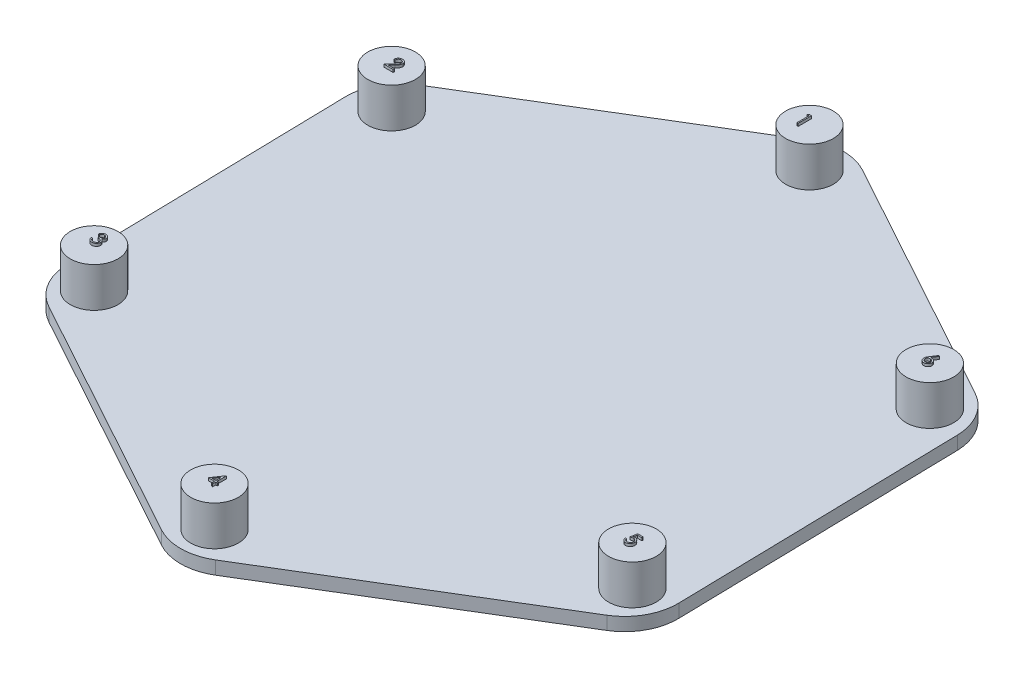
from build123d import *

# Parameters (mm, degrees)
BOSS_EXTRUDE1_DEPTH  = 25
BOSS_EXTRUDE2_DEPTH  = 10
SKETCH3_R            = 90
BOSS_EXTRUDE3_DEPTH  = 150
CIRPATTERN1_COUNT    = 6
BOSS_EXTRUDE4_DEPTH  = 10
BOSS_EXTRUDE5_DEPTH  = 10
BOSS_EXTRUDE6_DEPTH  = 10
BOSS_EXTRUDE7_DEPTH  = 10
BOSS_EXTRUDE8_DEPTH  = 10
BOSS_EXTRUDE9_DEPTH  = 10
FILLET1_R            = 200
BOSS_EXTRUDE11_DEPTH = 20
CIRPATTERN2_COUNT    = 6


with BuildPart() as part:
    # Sketch1 → Boss-Extrude1 (new, symmetric)
    with BuildSketch(Plane(origin=(0, 0, 0), x_dir=(1, 0, 0), z_dir=(0, 1, 0))):
        Polygon((-28.57133905, 1307.422876967), (-1146.547094467, 628.967933046), (-1117.975755417, -678.454943921), (28.57133905, -1307.422876967), (1146.547094467, -628.967933046), (1117.975755417, 678.454943921), align=None)
        Polygon((1068.618386374, 648.50192313), (-27.309946646, 1249.701631116), (-1095.92833302, 601.199707987), (-1068.618386374, -648.50192313), (27.309946646, -1249.701631116), (1095.92833302, -601.199707987), align=None, mode=Mode.SUBTRACT)
    extrude(amount=BOSS_EXTRUDE1_DEPTH, both=True)

    # Sketch2 → Boss-Extrude2 (add)
    with BuildSketch(Plane(origin=(0, 25, 0), x_dir=(1, 0, 0), z_dir=(0, 1, 0))):
        Polygon((1117.975755417, 678.454943921), (-28.57133905, 1307.422876967), (-1146.547094467, 628.967933046), (-1117.975755417, -678.454943921), (28.57133905, -1307.422876967), (1146.547094467, -628.967933046), align=None)
    extrude(amount=-BOSS_EXTRUDE2_DEPTH)

    # Sketch3 → Boss-Extrude3 (add)
    with BuildSketch(Plane(origin=(0, 25, 0), x_dir=(1, 0, 0), z_dir=(0, 1, 0))):
        with Locations(Location((-1008.254066379, 553.103731348, 0), (0, 0, 270))):
            Circle(SKETCH3_R)
    boss_extrude3 = extrude(amount=BOSS_EXTRUDE3_DEPTH)

    # CirPattern1: Boss-Extrude3 ×6 about axis
    cirpattern1_axis = Axis((0, 0, 0), (0, 1, 0))
    for i in range(1, CIRPATTERN1_COUNT):
        add(boss_extrude3.rotate(cirpattern1_axis, i * 360 / CIRPATTERN1_COUNT))

    # Sketch5 → Boss-Extrude4 (add)
    with BuildSketch(Plane(origin=(0, 175, 0), x_dir=(1, 0, 0), z_dir=(0, 1, 0))):
        Polygon((-50.30953318, 1173.045761191), (-41.064741514, 1173.045761191), (-41.064741514, 1123.045761191), (-45.551921001, 1123.045761191), (-45.551921001, 1167.917556063), (-53.244228693, 1167.917556063), align=None)
    extrude(amount=BOSS_EXTRUDE4_DEPTH)

    # Sketch6 → Boss-Extrude5 (add)
    with BuildSketch(Plane(origin=(0, 175, 0), x_dir=(1, 0, 0), z_dir=(0, 1, 0))):
        with BuildLine():
            Line((-1010.68012499, 568.449882479), (-1015.167304477, 568.449882479))
            add(Edge.make_bspline(
                [(-1015.167304477, 568.449882479), (-1015.138059434, 569.045180876), (-1015.080622948, 570.214331084), (-1014.811647387, 571.918958318), (-1014.426777713, 573.548312586), (-1013.882614084, 575.089311357), (-1013.206810116, 576.555580032), (-1012.396381153, 577.941294542), (-1011.436469003, 579.241168666), (-1010.347801374, 580.443152142), (-1009.165392244, 581.545831725), (-1007.889593109, 582.498049479), (-1006.548949862, 583.302587641), (-1005.147529877, 583.97517681), (-1003.669521826, 584.480031752), (-1002.128338143, 584.854626603), (-1000.517207623, 585.080002971), (-999.419493022, 585.104228479), (-998.861214733, 585.116549146)],
                knots=[0, 0, 0, 0, 1.10065271, 2.161652631, 3.183658789, 4.190468796, 5.17591951, 6.163126047, 7.15150782, 8.156236427, 9.156009102, 10.134482811, 11.092018607, 12.041330605, 13.001268258, 13.972401359, 14.968799086, 16, 16, 16, 16], degree=3))
            add(Edge.make_bspline(
                [(-998.861214733, 585.116549146), (-998.312956532, 585.103714054), (-997.235648751, 585.078493556), (-995.663334259, 584.861907424), (-994.166515767, 584.522684686), (-992.748119102, 584.046750168), (-991.419461037, 583.406972633), (-990.1705604, 582.638436367), (-988.986548818, 581.749581633), (-987.920737623, 580.703098584), (-986.942050777, 579.585921663), (-986.097732846, 578.393237325), (-985.374687654, 577.161390387), (-984.772006513, 575.880987507), (-984.328347385, 574.539972815), (-983.991515842, 573.157869918), (-983.801124218, 571.720372618), (-983.771903882, 570.747421823), (-983.757048067, 570.252767095)],
                knots=[0, 0, 0, 0, 1.111607364, 2.184268762, 3.212621178, 4.221274766, 5.211760367, 6.196651075, 7.1921475, 8.207485113, 9.220403448, 10.201281604, 11.166441695, 12.114753415, 13.065576456, 14.026450734, 14.996634279, 16, 16, 16, 16], degree=3))
            add(Edge.make_bspline(
                [(-983.757048067, 570.252767095), (-983.781237536, 569.556369458), (-983.829191984, 568.175794977), (-984.239397363, 566.147011223), (-984.880061808, 564.181390951), (-985.65145262, 562.599429492), (-986.429630392, 561.324665296), (-987.130880501, 560.275112368), (-987.951806372, 559.145034248), (-988.904356343, 557.938215143), (-989.968825945, 556.645202213), (-991.15485685, 555.266776565), (-992.470906594, 553.817179853), (-993.394599462, 552.827099833), (-993.873233964, 552.314065172)],
                knots=[0, 0, 0, 0, 1.184426356, 2.348067706, 3.509069118, 4.696110526, 5.333549288, 6.050745305, 6.844228056, 7.710549037, 8.667450064, 9.695053472, 10.805634456, 12, 12, 12, 12], degree=3))
            Line((-993.873233964, 552.314065172), (-1006.38324999, 538.962702992))
            Line((-1006.38324999, 538.962702992), (-983.116022426, 538.962702992))
            Line((-983.116022426, 538.962702992), (-983.116022426, 533.834497864))
            Line((-983.116022426, 533.834497864), (-1017.0903814, 533.834497864))
            Line((-1017.0903814, 533.834497864), (-997.699355759, 554.527606838))
            add(Edge.make_bspline(
                [(-997.699355759, 554.527606838), (-997.22724309, 555.020439789), (-996.320411274, 555.967071026), (-995.037803034, 557.349113314), (-993.885817487, 558.63124961), (-992.85699759, 559.811057445), (-991.973661799, 560.905794128), (-991.189772771, 561.880004179), (-990.5616929, 562.776496326), (-989.88004439, 563.815647954), (-989.219844656, 565.084395342), (-988.652525284, 566.634876617), (-988.306598878, 568.230980227), (-988.265101228, 569.309580756), (-988.244227554, 569.852126069)],
                knots=[0, 0, 0, 0, 1.329631726, 2.553950428, 3.673215718, 4.687767853, 5.603093632, 6.413772471, 7.123043292, 7.734684054, 8.834405432, 9.900288307, 10.943827018, 12, 12, 12, 12], degree=3))
            add(Edge.make_bspline(
                [(-988.244227554, 569.852126069), (-988.253309587, 570.193288903), (-988.27120853, 570.865655337), (-988.429175637, 571.851451895), (-988.667897152, 572.802377806), (-989.009972267, 573.721358079), (-989.461497126, 574.599153109), (-990.011116839, 575.436831398), (-990.645260602, 576.246673758), (-991.378850164, 577.006006587), (-992.184729018, 577.70145238), (-993.036075441, 578.317510743), (-993.936791216, 578.832355183), (-994.883078675, 579.254405142), (-995.872299667, 579.585482017), (-996.906367454, 579.814890294), (-997.98242483, 579.958925779), (-998.717189054, 579.978413949), (-999.091583323, 579.988344018)],
                knots=[0, 0, 0, 0, 0.991446411, 1.95395049, 2.89581595, 3.838931463, 4.798493298, 5.75982156, 6.748411868, 7.785213223, 8.824556874, 9.840280684, 10.836137867, 11.835679398, 12.848801643, 13.863922112, 14.911575587, 16, 16, 16, 16], degree=3))
            add(Edge.make_bspline(
                [(-999.091583323, 579.988344018), (-999.48259522, 579.978129271), (-1000.250478023, 579.958069195), (-1001.377892779, 579.817745424), (-1002.453403887, 579.57566199), (-1003.479716786, 579.244566641), (-1004.458568012, 578.82373023), (-1005.385197212, 578.299562449), (-1006.257524202, 577.674083975), (-1007.077188821, 576.96493317), (-1007.832388522, 576.17539601), (-1008.49591532, 575.295253681), (-1009.075686951, 574.340576318), (-1009.581533143, 573.313939881), (-1009.992328716, 572.206028739), (-1010.306230865, 571.020775812), (-1010.554614389, 569.763327506), (-1010.637593255, 568.894969151), (-1010.68012499, 568.449882479)],
                knots=[0, 0, 0, 0, 1.031018746, 2.02475058, 2.990194455, 3.934040569, 4.864654155, 5.795059489, 6.735614925, 7.690564532, 8.649604399, 9.611025574, 10.590972636, 11.591080095, 12.624614302, 13.701020113, 14.821632451, 16, 16, 16, 16], degree=3))
        make_face()
    extrude(amount=BOSS_EXTRUDE5_DEPTH)

    # Sketch7 → Boss-Extrude6 (add)
    with BuildSketch(Plane(origin=(0, 175, 0), x_dir=(1, 0, 0), z_dir=(0, 1, 0))):
        with BuildLine():
            Line((-997.390351393, -561.773098716), (-1001.87753088, -561.773098716))
            add(Edge.make_bspline(
                [(-1001.87753088, -561.773098716), (-1001.75596587, -561.269777516), (-1001.518316219, -560.285825739), (-1001.022636598, -558.880007727), (-1000.482647238, -557.549671707), (-999.834231459, -556.319727797), (-999.126963541, -555.165457758), (-998.316638948, -554.113041694), (-997.440642911, -553.135713616), (-996.471715064, -552.268381651), (-995.455591326, -551.48298552), (-994.377953901, -550.813341843), (-993.260483992, -550.237282517), (-992.095439235, -549.762707776), (-990.879351068, -549.405200295), (-989.623213592, -549.145817358), (-988.323735019, -548.977372869), (-987.441626582, -548.960933396), (-986.993716777, -548.952585895)],
                knots=[0, 0, 0, 0, 1.162005537, 2.271625781, 3.343758855, 4.383309926, 5.390229558, 6.379919256, 7.361854164, 8.333198761, 9.295911338, 10.242430842, 11.177959212, 12.116337295, 13.062827104, 14.020064771, 14.994644689, 16, 16, 16, 16], degree=3))
            add(Edge.make_bspline(
                [(-986.993716777, -548.952585895), (-986.341106176, -548.972289184), (-985.050120306, -549.011265977), (-983.153505349, -549.367186498), (-981.324550791, -549.930402675), (-979.583275822, -550.708598777), (-977.965869642, -551.668417536), (-976.52678126, -552.81077092), (-975.28551682, -554.113618084), (-974.244168567, -555.552654717), (-973.428811438, -557.090590566), (-972.827577531, -558.673449954), (-972.461553517, -560.297478116), (-972.414116991, -561.394010676), (-972.390351393, -561.943371152)],
                knots=[0, 0, 0, 0, 1.083050992, 2.142477498, 3.193116406, 4.255571735, 5.30263384, 6.308962982, 7.297363603, 8.282367274, 9.249857812, 10.179914175, 11.08814088, 12, 12, 12, 12], degree=3))
            add(Edge.make_bspline(
                [(-972.390351393, -561.943371152), (-972.406974122, -562.472039647), (-972.439502224, -563.506561854), (-972.715698017, -565.016868956), (-973.180501773, -566.440320389), (-973.824355524, -567.782908419), (-974.657806241, -569.036120416), (-975.667416197, -570.202776), (-976.860311365, -571.288049688), (-977.764296194, -571.909756445), (-978.229694341, -572.229829485)],
                knots=[0, 0, 0, 0, 1.024540389, 2.004866551, 2.965041327, 3.920577974, 4.882998113, 5.874504559, 6.905732034, 8, 8, 8, 8], degree=3))
            add(Edge.make_bspline(
                [(-978.229694341, -572.229829485), (-977.697812133, -572.486660507), (-976.643999644, -572.995517044), (-975.207563507, -573.993456437), (-973.90359386, -575.145689971), (-973.176397874, -576.044870727), (-972.81102447, -576.496656408)],
                knots=[0, 0, 0, 0, 1.015518401, 2.012035669, 3.001164323, 4, 4, 4, 4], degree=3))
            add(Edge.make_bspline(
                [(-972.81102447, -576.496656408), (-972.570433865, -576.82605286), (-972.093192492, -577.479451668), (-971.504113439, -578.529972038), (-970.96969752, -579.59213617), (-970.553265815, -580.694413399), (-970.230782003, -581.824027881), (-970.000267257, -582.982919253), (-969.857065244, -584.172033859), (-969.836557359, -584.976497862), (-969.826248829, -585.380871152)],
                knots=[0, 0, 0, 0, 1.025084078, 2.033381695, 3.024893161, 4.013698104, 4.991890475, 5.976764909, 6.982997093, 8, 8, 8, 8], degree=3))
            add(Edge.make_bspline(
                [(-969.826248829, -585.380871152), (-969.851884736, -586.081010026), (-969.903035908, -587.477992909), (-970.360236969, -589.541917504), (-971.068997551, -591.559424679), (-972.075525207, -593.48906524), (-973.302203905, -595.294499254), (-974.76159425, -596.909875098), (-976.43711437, -598.298426588), (-978.305766497, -599.458572703), (-980.330296904, -600.385971592), (-982.495662504, -601.029649347), (-984.770663275, -601.448877913), (-986.330767525, -601.493833183), (-987.123925111, -601.516688459)],
                knots=[0, 0, 0, 0, 0.955779014, 1.907060117, 2.875433937, 3.871313158, 4.872415639, 5.851225146, 6.836215519, 7.83643374, 8.849228613, 9.86973379, 10.916971861, 12, 12, 12, 12], degree=3))
            add(Edge.make_bspline(
                [(-987.123925111, -601.516688459), (-987.658486543, -601.504285413), (-988.710325187, -601.479880353), (-990.256660878, -601.313043193), (-991.732685155, -601.008328833), (-993.140393696, -600.598281613), (-994.481037073, -600.078399583), (-995.75052429, -599.430989612), (-996.956665626, -598.669396725), (-998.088079213, -597.784631185), (-999.144630181, -596.79489776), (-1000.098240527, -595.682626189), (-1000.964808997, -594.468377562), (-1001.721132408, -593.138048187), (-1002.401660302, -591.708830226), (-1002.961388254, -590.162423107), (-1003.454039235, -588.512651364), (-1003.683088724, -587.362969361), (-1003.800607803, -586.773098716)],
                knots=[0, 0, 0, 0, 1.048658725, 2.063410685, 3.046034179, 4.001477787, 4.936774919, 5.862367409, 6.792675028, 7.730719943, 8.675894397, 9.627829632, 10.600096036, 11.597688215, 12.626045268, 13.701542398, 14.82072376, 16, 16, 16, 16], degree=3))
            Line((-1003.800607803, -586.773098716), (-999.313428316, -586.773098716))
            add(Edge.make_bspline(
                [(-999.313428316, -586.773098716), (-999.196524152, -587.15808462), (-998.9691354, -587.906915643), (-998.582074, -588.984634295), (-998.141098684, -589.972606484), (-997.668033561, -590.878079655), (-997.171198618, -591.709971119), (-996.615271116, -592.446283534), (-996.041426185, -593.119357851), (-995.608863994, -593.498566593), (-995.39716229, -593.684156408)],
                knots=[0, 0, 0, 0, 1.198163088, 2.33053128, 3.407730985, 4.417276592, 5.372219308, 6.28897303, 7.162600585, 8, 8, 8, 8], degree=3))
            add(Edge.make_bspline(
                [(-995.39716229, -593.684156408), (-995.117211197, -593.899989749), (-994.558173156, -594.330990203), (-993.647198426, -594.881013468), (-992.689128625, -595.357599544), (-991.663204707, -595.72165234), (-990.591565129, -596.029904637), (-989.456888483, -596.231626339), (-988.269185381, -596.370028787), (-987.458217332, -596.382242094), (-987.043796905, -596.388483331)],
                knots=[0, 0, 0, 0, 0.946170439, 1.889420265, 2.845303464, 3.807233317, 4.801018734, 5.828864929, 6.890507805, 8, 8, 8, 8], degree=3))
            add(Edge.make_bspline(
                [(-987.043796905, -596.388483331), (-986.575889725, -596.379684685), (-985.660937626, -596.362479691), (-984.325868207, -596.204255308), (-983.055761813, -595.97382083), (-981.864720016, -595.617921075), (-980.73714134, -595.178194626), (-979.68883206, -594.626074548), (-978.706030543, -593.978292811), (-977.801324751, -593.242019116), (-976.987817501, -592.435997758), (-976.27153874, -591.592953885), (-975.662615005, -590.716442034), (-975.171421031, -589.801611736), (-974.783556026, -588.852251323), (-974.519510304, -587.865696618), (-974.335917231, -586.850021387), (-974.320965628, -586.159607544), (-974.313428316, -585.811560254)],
                knots=[0, 0, 0, 0, 1.217147791, 2.380027433, 3.494444702, 4.572153297, 5.609568379, 6.639424714, 7.649109417, 8.668170816, 9.669597737, 10.625200337, 11.543417969, 12.441394052, 13.322311151, 14.205496177, 15.095365482, 16, 16, 16, 16], degree=3))
            add(Edge.make_bspline(
                [(-974.313428316, -585.811560254), (-974.335289766, -585.345683985), (-974.378903887, -584.416249581), (-974.711883594, -583.048855663), (-975.259581654, -581.731378342), (-976.026331815, -580.486295627), (-976.959699367, -579.332354177), (-978.050626608, -578.30276157), (-979.308172728, -577.45318884), (-980.465599428, -576.866208035), (-981.49081595, -576.465678389), (-982.368178585, -576.198893183), (-983.350415776, -575.972983816), (-984.425649331, -575.762808508), (-985.601980995, -575.583932106), (-986.878130109, -575.43476331), (-988.254355274, -575.315405582), (-989.207086215, -575.262104221), (-989.6980437, -575.234637177)],
                knots=[0, 0, 0, 0, 1.07054697, 2.135767047, 3.216561865, 4.33974944, 5.486079747, 6.621378074, 7.775625952, 8.963672916, 9.598146892, 10.304877434, 11.070270905, 11.915000392, 12.823868403, 13.805723172, 14.86925407, 16, 16, 16, 16], degree=3))
            Line((-989.6980437, -575.234637177), (-989.6980437, -570.106432049))
            add(Edge.make_bspline(
                [(-989.6980437, -570.106432049), (-989.079455619, -570.095934853), (-987.867793525, -570.075373425), (-986.097874886, -569.826687562), (-984.405398998, -569.48267859), (-982.827874112, -568.955747272), (-981.39003535, -568.343743031), (-980.142612463, -567.631568609), (-979.103081788, -566.839929334), (-978.276495052, -565.956606344), (-977.654648929, -565.009248522), (-977.199980394, -564.021867698), (-976.931404305, -562.985809685), (-976.89555192, -562.278743), (-976.87753088, -561.9233391)],
                knots=[0, 0, 0, 0, 1.321986639, 2.589447074, 3.816329219, 5.01088745, 6.139805852, 7.153945165, 8.075214402, 8.924034688, 9.728124013, 10.488707548, 11.240355623, 12, 12, 12, 12], degree=3))
            add(Edge.make_bspline(
                [(-976.87753088, -561.9233391), (-976.883451036, -561.662228456), (-976.895228907, -561.142761211), (-977.043761447, -560.383831659), (-977.266962032, -559.64810386), (-977.573815308, -558.93870657), (-977.984532433, -558.2605598), (-978.476046526, -557.607881958), (-979.061305101, -556.984399401), (-979.731954344, -556.403251979), (-980.452122987, -555.849405734), (-981.241405487, -555.37921092), (-982.076003698, -554.977138604), (-982.956841624, -554.645574289), (-983.886777771, -554.396155885), (-984.861442881, -554.217072437), (-985.882695502, -554.105105941), (-986.579434531, -554.088985713), (-986.933620623, -554.080791023)],
                knots=[0, 0, 0, 0, 0.884392785, 1.759457502, 2.611959086, 3.489218968, 4.37281399, 5.2945488, 6.255912374, 7.266815255, 8.301784654, 9.332968512, 10.37626691, 11.440494194, 12.520033166, 13.637162961, 14.798855837, 16, 16, 16, 16], degree=3))
            add(Edge.make_bspline(
                [(-986.933620623, -554.080791023), (-987.502930166, -554.100667624), (-988.614924115, -554.139491246), (-990.217994356, -554.479534296), (-991.708270556, -555.022078346), (-992.847394365, -555.669692909), (-993.688573995, -556.308984821), (-994.289673113, -556.867304626), (-994.879966118, -557.487773536), (-995.420618645, -558.208607468), (-995.96738974, -558.980990185), (-996.465169191, -559.844185636), (-996.94887908, -560.775676983), (-997.240344075, -561.434186048), (-997.390351393, -561.773098716)],
                knots=[0, 0, 0, 0, 1.472543308, 2.876219568, 4.221790263, 5.565193594, 6.249813518, 6.953379497, 7.687249741, 8.463570142, 9.283606569, 10.136032583, 11.040678096, 12, 12, 12, 12], degree=3))
        make_face()
    extrude(amount=BOSS_EXTRUDE6_DEPTH)

    # Sketch8 → Boss-Extrude7 (add)
    with BuildSketch(Plane(origin=(0, 175, 0), x_dir=(1, 0, 0), z_dir=(0, 1, 0))):
        Polygon((31.342849512, -1112.370816369), (32.254307845, -1112.370816369), (32.254307845, -1146.986200984), (38.023538614, -1146.986200984), (38.023538614, -1152.114406112), (32.254307845, -1152.114406112), (32.254307845, -1163.652867651), (27.767128358, -1163.652867651), (27.767128358, -1152.114406112), (4.04917964, -1152.114406112), align=None)
        Polygon((27.767128358, -1146.986200984), (27.767128358, -1125.271457394), (12.863282204, -1146.986200984), align=None, mode=Mode.SUBTRACT)
    extrude(amount=BOSS_EXTRUDE7_DEPTH)

    # Sketch9 → Boss-Extrude8 (add)
    with BuildSketch(Plane(origin=(0, 175, 0), x_dir=(1, 0, 0), z_dir=(0, 1, 0))):
        with BuildLine():
            Line((1020.200037828, -524.076463643), (1020.200037828, -529.204668771))
            Line((1020.200037828, -529.204668771), (1003.19282629, -529.204668771))
            Line((1003.19282629, -529.204668771), (1000.498515393, -542.355710437))
            add(Edge.make_bspline(
                [(1000.498515393, -542.355710437), (1001.027885026, -542.209563697), (1002.053454967, -541.926427503), (1003.567167266, -541.612059354), (1005.004198745, -541.42255301), (1005.936704036, -541.396677146), (1006.387938469, -541.38415595)],
                knots=[0, 0, 0, 0, 1.100273476, 2.13160584, 3.095893838, 4, 4, 4, 4], degree=3))
            add(Edge.make_bspline(
                [(1006.387938469, -541.38415595), (1006.946277608, -541.396240746), (1008.044111856, -541.420002473), (1009.650382527, -541.648171751), (1011.183709573, -542.007313389), (1012.64088629, -542.509035128), (1014.024608442, -543.150602745), (1015.322145034, -543.952030464), (1016.552972363, -544.888220909), (1017.695009419, -545.964578223), (1018.731070964, -547.149172748), (1019.642013674, -548.42285662), (1020.415764964, -549.773251794), (1021.038061462, -551.21326049), (1021.534980523, -552.726962681), (1021.865723307, -554.330285289), (1022.085962006, -556.008115575), (1022.110567525, -557.155323719), (1022.123114752, -557.740325822)],
                knots=[0, 0, 0, 0, 1.052922333, 2.070308379, 3.05430497, 4.020497103, 4.973039431, 5.925935799, 6.892292201, 7.88610001, 8.88166317, 9.857072816, 10.836096531, 11.812156883, 12.81219415, 13.836441305, 14.89672472, 16, 16, 16, 16], degree=3))
            add(Edge.make_bspline(
                [(1022.123114752, -557.740325822), (1022.113613676, -558.147786113), (1022.094739924, -558.957200221), (1021.998760101, -560.159260231), (1021.813964157, -561.335872132), (1021.565853813, -562.487192015), (1021.24381927, -563.611040189), (1020.853975643, -564.710633445), (1020.376889536, -565.779127828), (1019.853584175, -566.826633471), (1019.264348775, -567.829469288), (1018.610370098, -568.767311953), (1017.919434509, -569.65423026), (1017.175986146, -570.48071216), (1016.373114787, -571.241326701), (1015.520543832, -571.940587865), (1014.625076417, -572.590321155), (1013.67285867, -573.164152515), (1012.685108913, -573.692194746), (1011.647562954, -574.125388136), (1010.583838662, -574.512681395), (1009.478626153, -574.821388932), (1008.33442883, -575.063282568), (1007.149360609, -575.227576862), (1005.929636751, -575.347240255), (1005.102850857, -575.354731068), (1004.685214111, -575.358514925)],
                knots=[0, 0, 0, 0, 1.056347294, 2.098418968, 3.122841568, 4.141288669, 5.149314143, 6.15115421, 7.162517403, 8.180376062, 9.185164535, 10.17417709, 11.141909838, 12.097768115, 13.052685741, 14.0056014, 14.954263652, 15.917497458, 16.885230207, 17.854509472, 18.828990115, 19.81800267, 20.826176721, 21.857883937, 22.917946725, 24, 24, 24, 24], degree=3))
            add(Edge.make_bspline(
                [(1004.685214111, -575.358514925), (1004.187011529, -575.348645811), (1003.206856805, -575.329229495), (1001.770848704, -575.126108277), (1000.389211479, -574.835195185), (999.073067177, -574.397534187), (997.810620553, -573.849144263), (996.618867442, -573.156056099), (995.467356355, -572.370640331), (994.402898687, -571.443778146), (993.414954209, -570.430696974), (992.530575511, -569.3313021), (991.742952986, -568.163738642), (991.064699458, -566.922336441), (990.486156296, -565.610357428), (990.031656464, -564.222885986), (989.664822822, -562.767171644), (989.509631101, -561.764978638), (989.430807059, -561.255950822)],
                knots=[0, 0, 0, 0, 1.0467383, 2.05933395, 3.04377827, 4.011590433, 4.970194871, 5.932262533, 6.905835911, 7.896367577, 8.894135286, 9.877477877, 10.858688626, 11.851381753, 12.8477658, 13.868841284, 14.917554742, 16, 16, 16, 16], degree=3))
            Line((989.430807059, -561.255950822), (993.917986546, -561.255950822))
            add(Edge.make_bspline(
                [(993.917986546, -561.255950822), (994.028394509, -561.732757286), (994.240604744, -562.649205784), (994.706401155, -563.936796374), (995.275913661, -565.084213855), (995.953118639, -566.106636474), (996.760976217, -566.998193577), (997.682825202, -567.792723034), (998.716364105, -568.509510595), (999.864838812, -569.106978698), (1001.076454231, -569.616532318), (1002.344557231, -569.955842246), (1003.634619324, -570.19442643), (1004.507167469, -570.218308727), (1004.945630777, -570.230309796)],
                knots=[0, 0, 0, 0, 1.136247022, 2.183929868, 3.172523383, 4.106158343, 5.02341133, 5.958108904, 6.928429099, 7.938127109, 8.96079061, 9.975095812, 10.982467395, 12, 12, 12, 12], degree=3))
            add(Edge.make_bspline(
                [(1004.945630777, -570.230309796), (1005.373608555, -570.218584398), (1006.2163003, -570.195496992), (1007.456462967, -570.017796819), (1008.653789741, -569.744117229), (1009.796466267, -569.334547872), (1010.904488261, -568.83676618), (1011.949827838, -568.197979383), (1012.962726083, -567.462836262), (1013.911699419, -566.62059869), (1014.780834409, -565.692460196), (1015.548778996, -564.699926004), (1016.188449188, -563.64111391), (1016.727507886, -562.534354584), (1017.136840726, -561.367518053), (1017.428854744, -560.146072693), (1017.600327013, -558.867001548), (1017.623915298, -557.994582836), (1017.635935264, -557.550021335)],
                knots=[0, 0, 0, 0, 1.027316725, 2.022795036, 3.002884548, 3.971462791, 4.93288096, 5.914575861, 6.907176829, 7.935150275, 8.956128384, 9.956726525, 10.942570165, 11.921478529, 12.907843606, 13.90538589, 14.932640048, 16, 16, 16, 16], degree=3))
            add(Edge.make_bspline(
                [(1017.635935264, -557.550021335), (1017.626528415, -557.148939169), (1017.608115846, -556.363877897), (1017.457679127, -555.215317805), (1017.196008093, -554.128560057), (1016.832809808, -553.098356715), (1016.371673984, -552.12373611), (1015.808155236, -551.203692393), (1015.131678123, -550.350351918), (1014.358936857, -549.563315438), (1013.512393415, -548.836960083), (1012.577482807, -548.217758848), (1011.573769567, -547.696845738), (1010.513346717, -547.247302905), (1009.370991023, -546.924435114), (1008.169324846, -546.68203675), (1006.895371875, -546.541817283), (1006.024362045, -546.522361735), (1005.576640393, -546.512361078)],
                knots=[0, 0, 0, 0, 1.045622112, 2.046656509, 3.013763289, 3.955457236, 4.890082067, 5.820317437, 6.762574623, 7.722996705, 8.69280354, 9.665887285, 10.63943826, 11.638615906, 12.663482002, 13.728887084, 14.832589034, 16, 16, 16, 16], degree=3))
            add(Edge.make_bspline(
                [(1005.576640393, -546.512361078), (1005.189084267, -546.520655238), (1004.388879191, -546.537780573), (1003.161410237, -546.663873385), (1001.871528481, -546.867291876), (1000.524178544, -547.147095412), (999.115314143, -547.513253651), (997.647908418, -547.952032231), (996.118876038, -548.476632213), (995.088622832, -548.872806695), (994.559012187, -549.076463643)],
                knots=[0, 0, 0, 0, 0.817624296, 1.688186739, 2.600797293, 3.572016777, 4.590301741, 5.671205678, 6.80286297, 8, 8, 8, 8], degree=3))
            Line((994.559012187, -549.076463643), (999.687217316, -524.076463643))
            Line((999.687217316, -524.076463643), (1020.200037828, -524.076463643))
        make_face()
    extrude(amount=BOSS_EXTRUDE8_DEPTH)

    # Sketch10 → Boss-Extrude9 (add)
    with BuildSketch(Plane(origin=(0, 175, 0), x_dir=(1, 0, 0), z_dir=(0, 1, 0))):
        with BuildLine():
            Line((985.196446995, 629.38361374), (988.651975841, 626.669270791))
            Line((988.651975841, 626.669270791), (975.44083802, 606.466947073))
            add(Edge.make_bspline(
                [(975.44083802, 606.466947073), (976.320413406, 606.607145082), (978.036124645, 606.880617151), (979.772780339, 606.925730658), (980.619123277, 606.947716304)],
                knots=[0, 0, 0, 0, 1.025318673, 2, 2, 2, 2], degree=3))
            add(Edge.make_bspline(
                [(980.619123277, 606.947716304), (981.127301796, 606.934057565), (982.127636088, 606.907170745), (983.59630469, 606.700258592), (985.007575204, 606.374185565), (986.355598237, 605.898867623), (987.645212263, 605.291691132), (988.883817922, 604.563992985), (990.048132352, 603.678197551), (991.153149198, 602.688698183), (992.156393446, 601.592741261), (993.044622811, 600.429865023), (993.790719836, 599.201281008), (994.396061574, 597.907611495), (994.866131268, 596.550850644), (995.208811911, 595.132734366), (995.411377523, 593.652284774), (995.438884533, 592.645453698), (995.452857251, 592.134014381)],
                knots=[0, 0, 0, 0, 1.04369286, 2.054478336, 3.041073146, 4.015093852, 4.984733326, 5.965804835, 6.960378782, 7.985147595, 9.009457201, 10.008161701, 10.986880575, 11.956520048, 12.937015923, 13.931873656, 14.949455224, 16, 16, 16, 16], degree=3))
            add(Edge.make_bspline(
                [(995.452857251, 592.134014381), (995.432527181, 591.434304324), (995.392522415, 590.057440525), (994.993896758, 588.052059005), (994.374473261, 586.141594497), (993.489079998, 584.356549192), (992.38933167, 582.699369627), (991.048223203, 581.231005835), (989.513316227, 579.921433873), (987.777790539, 578.826339313), (985.910033909, 577.932010013), (983.947862517, 577.289649412), (981.910331855, 576.894171277), (980.527408883, 576.844591239), (979.827857251, 576.819511175)],
                knots=[0, 0, 0, 0, 1.031375318, 2.029502543, 3.004789286, 3.987476834, 4.960371455, 5.9300674, 6.912260825, 7.929083631, 8.949397511, 9.960523116, 10.96833055, 12, 12, 12, 12], degree=3))
            add(Edge.make_bspline(
                [(979.827857251, 576.819511175), (979.155047242, 576.841342686), (977.822328413, 576.884587086), (975.861859924, 577.26981477), (973.978102533, 577.894201953), (972.184254235, 578.754405932), (970.522531193, 579.840947117), (969.035879244, 581.148979676), (967.731711036, 582.650543463), (966.646359308, 584.345405566), (965.78552028, 586.166690674), (965.139949922, 588.065792908), (964.762860733, 590.035792647), (964.710167063, 591.371237492), (964.683626482, 592.04387015)],
                knots=[0, 0, 0, 0, 1.012016664, 2.004627821, 2.994792927, 3.992885782, 4.990978636, 5.973936114, 6.964471063, 7.975201453, 8.993600317, 9.990122807, 10.98767138, 12, 12, 12, 12], degree=3))
            add(Edge.make_bspline(
                [(964.683626482, 592.04387015), (964.700504268, 592.558792767), (964.734965481, 593.610166367), (964.975585343, 595.202509623), (965.362225269, 596.831810791), (965.795228788, 598.214013557), (966.252737503, 599.346321013), (966.633488069, 600.259228022), (967.107402298, 601.198671925), (967.612736315, 602.196866725), (968.194977299, 603.228087192), (968.828058005, 604.309568184), (969.529481589, 605.424110008), (970.0211982, 606.180455655), (970.27256879, 606.567107329)],
                knots=[0, 0, 0, 0, 1.173818275, 2.396712641, 3.66331629, 4.989737886, 5.693666774, 6.447286557, 7.243889047, 8.091586357, 8.998013824, 9.943181721, 10.948533338, 12, 12, 12, 12], degree=3))
            Line((970.27256879, 606.567107329), (985.196446995, 629.38361374))
        make_face()
        with BuildLine():
            add(Edge.make_bspline(
                [(979.677616866, 601.819511175), (979.296727655, 601.808396266), (978.552740377, 601.786685618), (977.461205881, 601.660610591), (976.428159432, 601.423195368), (975.439914666, 601.120819197), (974.514947481, 600.705061201), (973.646535483, 600.200035502), (972.831320456, 599.605447243), (972.077841146, 598.929719941), (971.394703098, 598.189890898), (970.80640123, 597.397469153), (970.298938372, 596.571551966), (969.886340959, 595.705238506), (969.565054162, 594.79885994), (969.332650578, 593.856584949), (969.203311275, 592.872094862), (969.181793682, 592.20448768), (969.170805969, 591.863581688)],
                knots=[0, 0, 0, 0, 1.129588631, 2.206414736, 3.251139165, 4.268635594, 5.265702196, 6.250456724, 7.242448911, 8.251968645, 9.246821453, 10.222880186, 11.173611482, 12.116736599, 13.062300278, 14.020270554, 14.989073742, 16, 16, 16, 16], degree=3))
            add(Edge.make_bspline(
                [(969.170805969, 591.863581688), (969.17975399, 591.525724833), (969.197299728, 590.863237836), (969.356618583, 589.886963843), (969.599976902, 588.947465151), (969.961982557, 588.049585168), (970.393795245, 587.179637768), (970.963871305, 586.36913369), (971.595539674, 585.568846974), (972.350595866, 584.840254525), (973.160929623, 584.162302751), (974.026661087, 583.569727701), (974.928946228, 583.062782367), (975.879966543, 582.665480972), (976.866229171, 582.339419732), (977.895951372, 582.109970028), (978.969849308, 581.980248228), (979.697305566, 581.958702605), (980.068241866, 581.947716304)],
                knots=[0, 0, 0, 0, 0.989467248, 1.94019797, 2.891935182, 3.827694429, 4.772920941, 5.730924762, 6.725747692, 7.756678648, 8.79901574, 9.819492441, 10.826891316, 11.826466727, 12.835195252, 13.867842842, 14.912794438, 16, 16, 16, 16], degree=3))
            add(Edge.make_bspline(
                [(980.068241866, 581.947716304), (980.43917756, 581.958703466), (981.166632625, 581.980250779), (982.2405392, 582.109960334), (983.270229466, 582.339455304), (984.25660816, 582.665352022), (985.207200033, 583.06326073), (986.108696054, 583.56657387), (986.966240248, 584.16594698), (987.777105956, 584.839095955), (988.52901936, 585.57299384), (989.17583763, 586.361989875), (989.728455248, 587.186188379), (990.177515063, 588.046158235), (990.53553351, 588.948008058), (990.780125899, 589.8868184), (990.939115741, 590.863275914), (990.956706687, 591.525737693), (990.965677764, 591.863581688)],
                knots=[0, 0, 0, 0, 1.087397944, 2.132534446, 3.165364764, 4.174271784, 5.174024072, 6.181601208, 7.194203697, 8.236725232, 9.267838612, 10.269026844, 11.221737037, 12.171628256, 13.107553087, 14.05945871, 15.010357665, 16, 16, 16, 16], degree=3))
            add(Edge.make_bspline(
                [(990.965677764, 591.863581688), (990.957816435, 592.204932416), (990.942387204, 592.87489288), (990.767873653, 593.856144569), (990.525839741, 594.803647515), (990.160367873, 595.711446787), (989.685560091, 596.575960034), (989.107225705, 597.401554332), (988.438188987, 598.194559294), (987.665366992, 598.931170842), (986.824077936, 599.604700527), (985.929569573, 600.199265618), (984.993741378, 600.701050999), (984.0175422, 601.119723889), (982.989786734, 601.421859234), (981.927067602, 601.659762706), (980.815792707, 601.786362959), (980.06184116, 601.808321033), (979.677616866, 601.819511175)],
                knots=[0, 0, 0, 0, 0.978206639, 1.919901502, 2.851605144, 3.780102724, 4.718870031, 5.675451981, 6.667674623, 7.690630536, 8.733308323, 9.756129687, 10.767539656, 11.776269907, 12.797430371, 13.836405707, 14.897401972, 16, 16, 16, 16], degree=3))
        make_face(mode=Mode.SUBTRACT)
    extrude(amount=BOSS_EXTRUDE9_DEPTH)

    # Fillet1
    fillet1_edges = [part.edges().sort_by_distance(p)[0] for p in [
        (1117.975755417, 0, -678.454943921),
        (1146.547094467, 0, 628.967933046),
        (28.57133905, 0, 1307.422876967),
        (-1117.975755417, 0, 678.454943921),
        (-1146.547094467, 0, -628.967933046),
        (-28.57133905, 0, -1307.422876967),
    ]]
    fillet(fillet1_edges, radius=FILLET1_R)

    # Sketch13 → Boss-Extrude11 (add)
    with BuildSketch(Plane.XZ.offset(-15)):
        with BuildLine():
            ThreePointArc((16.21989933, 1199.930379199), (26.218422696, 1199.753555684), (36.215125428, 1199.493420057))
            Line((36.215125428, 1199.493420057), (37.181420456, 1243.711026957))
            Line((37.181420456, 1243.711026957), (27.309946646, 1249.701631116))
            Line((27.309946646, 1249.701631116), (17.186194358, 1244.147986105))
            Line((17.186194358, 1244.147986105), (16.21989933, 1199.930379199))
        make_face()
    boss_extrude11 = extrude(amount=BOSS_EXTRUDE11_DEPTH)

    # CirPattern2: Boss-Extrude11 ×6 about axis
    cirpattern2_axis = Axis((0, 0, 0), (0, 1, 0))
    for i in range(1, CIRPATTERN2_COUNT):
        add(boss_extrude11.rotate(cirpattern2_axis, i * 360 / CIRPATTERN2_COUNT))


solid = part.part
